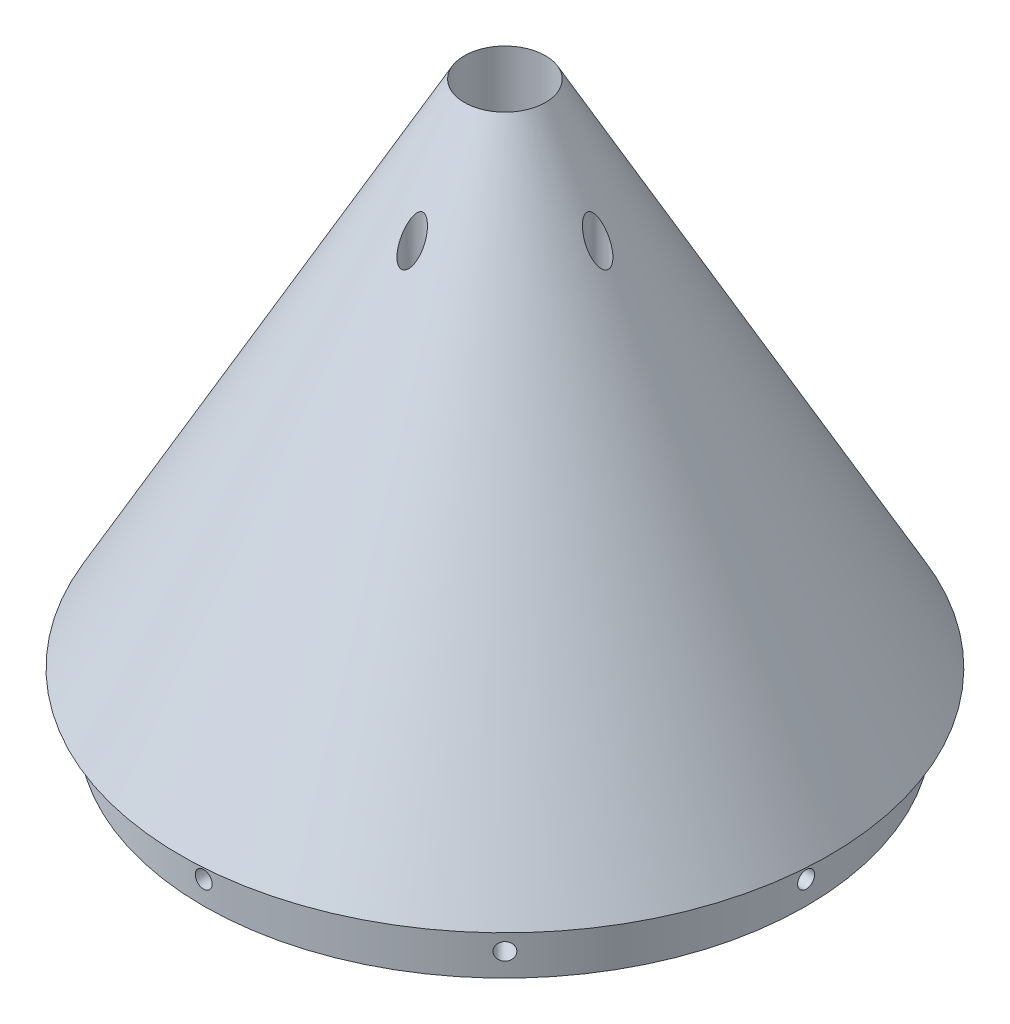
from build123d import *

# Parameters (mm, degrees)
SKETCH1_R           = 65
SKETCH1_R_2         = 8.75
BOSS_EXTRUDE1_DEPTH = 12
SKETCH2_R           = 1.825
CUT_EXTRUDE1_DEPTH  = 11
CIRPATTERN1_COUNT   = 8
SKETCH9_R           = 2.325
CUT_EXTRUDE3_DEPTH  = 65
CIRPATTERN2_COUNT   = 4
SKETCH11_R          = 17.5
CUT_EXTRUDE5_DEPTH  = 53.25


with BuildPart() as part:
    # Sketch1 → Boss-Extrude1 (new body)
    with BuildSketch(Plane(origin=(0, 0, 0), x_dir=(1, 0, 0), z_dir=(0, 1, 0))):
        with Locations(Location((0, 0, 0), (0, 0, 270))):
            Circle(SKETCH1_R)
        with Locations(Location((0, 0, 0), (0, 0, 270))):
            Circle(SKETCH1_R_2, mode=Mode.SUBTRACT)
    extrude(amount=BOSS_EXTRUDE1_DEPTH)

    # Sketch2 → Cut-Extrude1 (cut)
    with BuildSketch(Plane.ZY.offset(65)):
        with Locations((0, 5)):
            Circle(SKETCH2_R)
    cut_extrude1 = extrude(amount=-CUT_EXTRUDE1_DEPTH, mode=Mode.SUBTRACT)

    # CirPattern1: Cut-Extrude1 ×8 about axis
    cirpattern1_axis = Axis((0, 0, 0), (0, 1, 0))
    for i in range(1, CIRPATTERN1_COUNT):
        add(cut_extrude1.rotate(cirpattern1_axis, i * 360 / CIRPATTERN1_COUNT), mode=Mode.SUBTRACT)

    # Sketch6 → Revolve1 (revolve)
    with BuildSketch(Plane.XY, mode=Mode.PRIVATE) as revolve1_sk:
        Polygon((-8.75, 12), (-8.75, 122), (-70, 12), align=None)
    revolve(revolve1_sk.sketch.rotate(Axis((0, -6, 0), (0, 1, 0)), 270), axis=Axis((0, -6, 0), (0, 1, 0)))

    # Sketch9 → Cut-Extrude3 (cut)
    with BuildSketch(Plane(origin=(0, 120, 0), x_dir=(1, 0, 0), z_dir=(0, 1, 0))):
        with Locations(Location((20, 0, 0), (0, 0, 270))):
            Circle(SKETCH9_R)
    cut_extrude3 = extrude(amount=-CUT_EXTRUDE3_DEPTH, mode=Mode.SUBTRACT)

    # CirPattern2: Cut-Extrude3 ×4 about axis
    cirpattern2_axis = Axis((0, 0, 0), (0, 1, 0))
    for i in range(1, CIRPATTERN2_COUNT):
        add(cut_extrude3.rotate(cirpattern2_axis, i * 360 / CIRPATTERN2_COUNT), mode=Mode.SUBTRACT)

    # Sketch11 → Cut-Extrude5 (cut)
    with BuildSketch(Plane.XZ):
        with Locations(Location((0, 0, 0), (0, 0, 270))):
            Circle(SKETCH11_R)
    extrude(amount=-CUT_EXTRUDE5_DEPTH, mode=Mode.SUBTRACT)


solid = part.part
